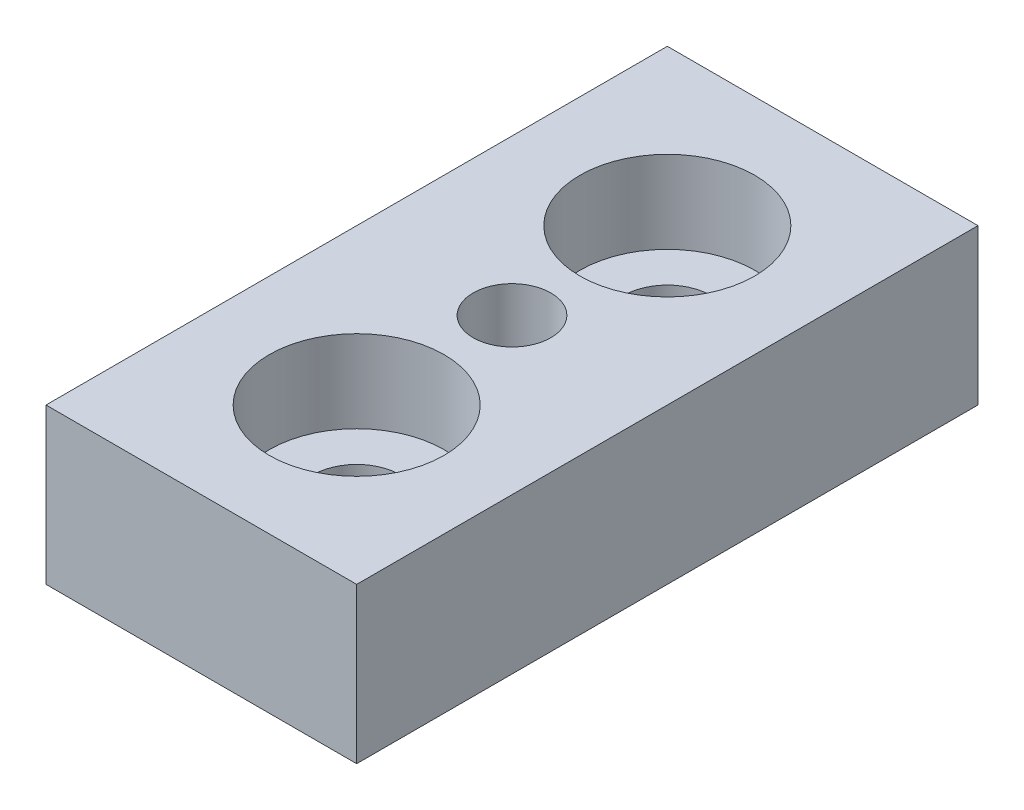
from build123d import *

# Parameters (mm, degrees)
SKETCH1_W                                            = 25.4
SKETCH1_H                                            = 50.8
EXTRUDE1_DEPTH                                       = 12.7
F_1_4_0_25_DIAMETER_HOLE1_D                          = 6.35
CBORE_FOR_1_4_BINDING_HEAD_MACHINE_SCREW_D           = 7.14248
CBORE_FOR_1_4_BINDING_HEAD_MACHINE_SCREW_CBORE_D     = 14.2875
CBORE_FOR_1_4_BINDING_HEAD_MACHINE_SCREW_CBORE_DEPTH = 6.731


with BuildPart() as part:
    # Sketch1 → Extrude1 (new body)
    with BuildSketch(Plane(origin=(0, 0, 0), x_dir=(1, 0, 0), z_dir=(0, 1, 0))):
        Rectangle(SKETCH1_W, SKETCH1_H)
    extrude(amount=EXTRUDE1_DEPTH)

    # 1/4 (0.25) Diameter Hole1 (through all)
    with Locations(Plane(origin=(0, 12.7, 0), x_dir=(-1, 0, 0), z_dir=(0, 1, 0))):
        with Locations((0, 0)):
            Hole(F_1_4_0_25_DIAMETER_HOLE1_D / 2)

    # CBORE for 1/4 Binding Head Machine Screw1 (through all)
    with Locations(Plane(origin=(0, 12.7, 0), x_dir=(-1, 0, 0), z_dir=(0, 1, 0))):
        with Locations((0, -12.7), (0, 12.7)):
            CounterBoreHole(CBORE_FOR_1_4_BINDING_HEAD_MACHINE_SCREW_D / 2, CBORE_FOR_1_4_BINDING_HEAD_MACHINE_SCREW_CBORE_D / 2, CBORE_FOR_1_4_BINDING_HEAD_MACHINE_SCREW_CBORE_DEPTH)


solid = part.part
